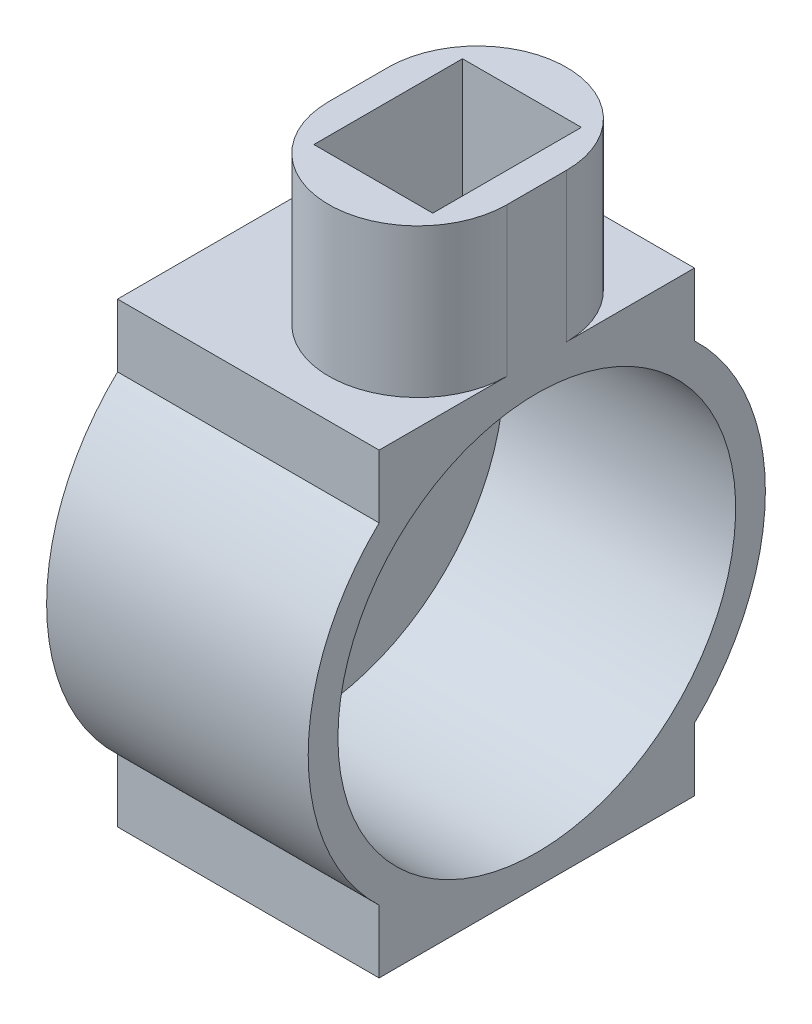
from build123d import *

# Parameters (mm, degrees)
SKETCH1_R                = 38.45
BOSS_EXTRUDE1_DEPTH      = 55.5
SHELL1_T                 = -5
BOSS_EXTRUDE2_REACH      = 104.334
BOSS_EXTRUDE2_END_RADIUS = 38.45
SKETCH2_W                = 111
SKETCH2_H                = 53.04
CUT_EXTRUDE1_REACH       = 104.334
CUT_EXTRUDE1_END_RADIUS  = 33.45
SKETCH3_W                = 20
SKETCH3_H                = 25
BOSS_EXTRUDE5_DEPTH      = 25
CUT_EXTRUDE2_REACH       = 124.239
SKETCH6_W                = 20
SKETCH6_H                = 25
CUT_EXTRUDE3_DEPTH       = 103.334073016
CUT_EXTRUDE3_DEPTH_BACK  = 103.334073016
SKETCH7_W                = 67
SKETCH7_H                = 76.9


with BuildPart() as part:
    # Sketch1 → Boss-Extrude1 (new, symmetric)
    with BuildSketch(Plane(origin=(0, 0, 0), x_dir=(0, 0, -1), z_dir=(1, 0, 0))):
        Circle(SKETCH1_R)
    extrude(amount=BOSS_EXTRUDE1_DEPTH, both=True)

    # Shell1
    shell1_openings = [part.faces().sort_by_distance(p)[0] for p in [
        (55.5, 0, 0),
    ]]
    offset(amount=SHELL1_T, openings=shell1_openings, kind=Kind.INTERSECTION)

    # Boss-Extrude2: up to this cylinder (the profile starts outside it)
    boss_extrude2_end = Plane(origin=(0, 0, 0), z_dir=(-1, 0, 0)) * Cylinder(BOSS_EXTRUDE2_END_RADIUS, 286.568, mode=Mode.PRIVATE)
    # Sketch2 → Boss-Extrude2 (add, up to the surface)
    with BuildSketch(Plane(origin=(0, 38.45, 0), x_dir=(1, 0, 0), z_dir=(0, 1, 0)), mode=Mode.PRIVATE) as boss_extrude2_sk1:
        Rectangle(SKETCH2_W, SKETCH2_H)
    boss_extrude2_tool1 = extrude(boss_extrude2_sk1.sketch, amount=-BOSS_EXTRUDE2_REACH, mode=Mode.PRIVATE) - boss_extrude2_end
    boss_extrude2 = boss_extrude2_tool1.solids().sort_by_distance((0, 38.45, 0))[0] + boss_extrude2_tool1.solids().sort_by_distance((0, 38.45, 0))[1]
    add(boss_extrude2)

    # Mirror1: Boss-Extrude2 across plane
    add(boss_extrude2.mirror(Plane.ZX))

    # Cut-Extrude1: up to this cylinder (the profile starts outside it)
    cut_extrude1_end = Plane(origin=(-26.5, 0, 0), z_dir=(-1, 0, 0)) * Cylinder(CUT_EXTRUDE1_END_RADIUS, 276.568, mode=Mode.PRIVATE)
    # Sketch3 → Cut-Extrude1 (cut, up to the surface)
    with BuildSketch(Plane(origin=(0, 38.45, 0), x_dir=(1, 0, 0), z_dir=(0, 1, 0)), mode=Mode.PRIVATE) as cut_extrude1_sk1:
        with Locations((-26.5, 0)):
            Rectangle(SKETCH3_W, SKETCH3_H)
    cut_extrude1_tool1 = extrude(cut_extrude1_sk1.sketch, amount=-CUT_EXTRUDE1_REACH, mode=Mode.PRIVATE) - cut_extrude1_end
    add(cut_extrude1_tool1.solids().sort_by_distance((-26.5, 38.45, 0))[0], mode=Mode.SUBTRACT)

    # Sketch5 → Boss-Extrude5 (add)
    with BuildSketch(Plane(origin=(0, 38.45, 0), x_dir=(1, 0, 0), z_dir=(0, 1, 0))):
        with BuildLine():
            Line((-11.5, 5), (-11.5, -5))
            ThreePointArc((-11.5, -5), (-26.5, -20), (-41.5, -5))
            Line((-41.5, -5), (-41.5, 5))
            ThreePointArc((-41.5, 5), (-26.5, 20), (-11.5, 5))
        make_face()
    extrude(amount=BOSS_EXTRUDE5_DEPTH)

    # Sketch6 → Cut-Extrude2 (cut, up to next)
    with BuildSketch(Plane(origin=(0, 63.45, 0), x_dir=(1, 0, 0), z_dir=(0, 1, 0)), mode=Mode.PRIVATE) as cut_extrude2_sk1:
        with Locations((-26.5, 0)):
            Rectangle(SKETCH6_W, SKETCH6_H)
    cut_extrude2_tool1 = extrude(cut_extrude2_sk1.sketch, amount=-CUT_EXTRUDE2_REACH, mode=Mode.PRIVATE) & part.part
    add(cut_extrude2_tool1.solids().sort_by_distance((-26.5, 63.45, 0))[0], mode=Mode.SUBTRACT)

    # Sketch7 → Cut-Extrude3 (cut, two sides: drawn at the far end of the back side and taken through both)
    with BuildSketch(Plane(origin=(0, 38.45, 0), x_dir=(1, 0, 0), z_dir=(0, 1, 0)).offset(-CUT_EXTRUDE3_DEPTH_BACK)):
        with Locations((22, 0)):
            Rectangle(SKETCH7_W, SKETCH7_H)
    extrude(amount=CUT_EXTRUDE3_DEPTH + CUT_EXTRUDE3_DEPTH_BACK, mode=Mode.SUBTRACT)


solid = part.part
